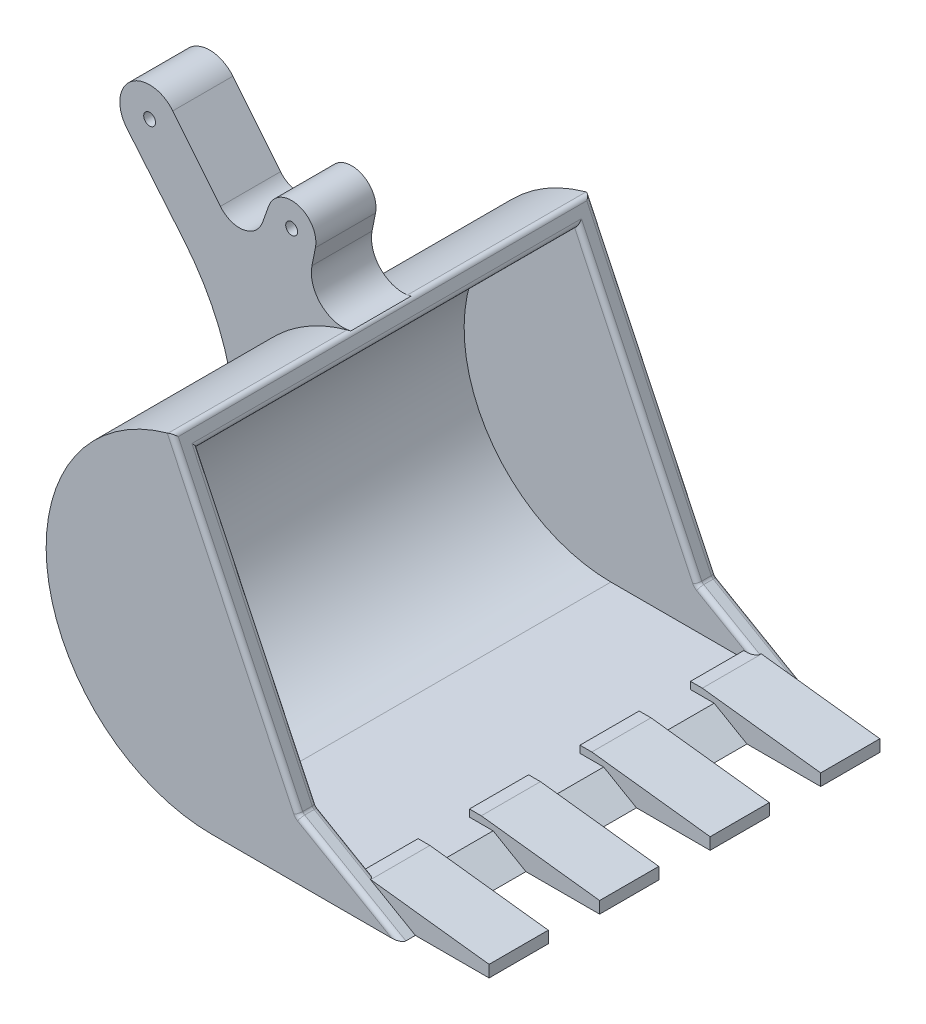
from build123d import *

# Parameters (mm, degrees)
BOSS_EXTRUDE1_DEPTH             = 75
BOSS_EXTRUDE1_DEPTH_BACK        = 101.6
SHELL2_T                        = -8
BOSS_EXTRUDE2_DEPTH             = 12.7
CUT_EXTRUDE1_DEPTH              = 20
CUT_EXTRUDE1_DEPTH_BACK         = 20
SKETCH8_R                       = 2.5
FILLET3_R                       = 2
BOSS_EXTRUDE3_DEPTH             = 3
BOSS_EXTRUDE3_DIRECTION_2_REACH = 518.917
CUT_EXTRUDE4_DEPTH              = 25
LPATTERN2_COUNT                 = 4
LPATTERN2_PITCH                 = 46.7


with BuildPart() as part:
    # Sketch3 → Boss-Extrude1 (new, two sides: drawn at the far end of the back side and taken through both)
    with BuildSketch(Plane.XY.offset(-BOSS_EXTRUDE1_DEPTH_BACK)):
        with BuildLine():
            Line((-323.559783679, 25), (-280.25851349, 0))
            Line((-280.25851349, 0), (-360.25851349, 0))
            ThreePointArc((-360.25851349, 0), (-429.739955011, 61.495337509), (-377.141833761, 137.933449026))
            Line((-377.141833761, 137.933449026), (-323.559783679, 25))
        make_face()
    extrude(amount=BOSS_EXTRUDE1_DEPTH + BOSS_EXTRUDE1_DEPTH_BACK)

    # Shell2
    shell2_openings = [part.faces().sort_by_distance(p)[0] for p in [
        (-350.35080872, 81.466724513, -13.3),
        (-301.909148584, 12.5, -13.3),
    ]]
    offset(amount=SHELL2_T, openings=shell2_openings, kind=Kind.INTERSECTION)

    # Fillet3
    fillet3_edges = [part.edges().sort_by_distance(p)[0] for p in [
        (-301.909148584, 12.5, -101.6),
        (-350.35080872, 81.466724513, -101.6),
        (-301.909148584, 12.5, 75),
        (-350.35080872, 81.466724513, 75),
        (-323.559783679, 25, 71),
        (-373.633981695, 130.540043362, -13.3),
        (-348.596882687, 77.770021681, -93.6),
        (-308.837351815, 16.5, -93.6),
        (-308.837351815, 16.5, 67),
        (-348.596882687, 77.770021681, 67),
        (-377.141833761, 137.933449026, -13.3),
        (-323.559783679, 25, -97.6),
    ]]
    fillet(fillet3_edges, radius=FILLET3_R)

    # Sketch17 → Boss-Extrude3 (add)
    with BuildSketch(Plane(origin=(0, 8, 0), x_dir=(1, 0, 0), z_dir=(0, 1, 0))):
        Polygon((-294.11491995, -44), (-304.11491995, -44), (-304.11491995, -69), (-294.11491995, -69), (-249.11491995, -69), (-249.11491995, -44), align=None)
    boss_extrude3 = extrude(amount=BOSS_EXTRUDE3_DEPTH)

    # Boss-Extrude3 direction 2: up to this face of the body (flat: up to its plane)
    boss_extrude3_direction_2_end = Plane(part.part.faces().sort_by_distance((-320.268020141, 0, -13.3))[0])
    # Sketch17 → Boss-Extrude3 direction 2 (add, up to the picked face)
    with BuildSketch(Plane(origin=(0, 8, 0), x_dir=(1, 0, 0), z_dir=(0, 1, 0)), mode=Mode.PRIVATE) as boss_extrude3_direction_2_sk1:
        Polygon((-294.11491995, -44), (-304.11491995, -44), (-304.11491995, -69), (-294.11491995, -69), (-249.11491995, -69), (-249.11491995, -44), align=None)
    boss_extrude3_direction_2_tool1 = split(extrude(boss_extrude3_direction_2_sk1.sketch, amount=-BOSS_EXTRUDE3_DIRECTION_2_REACH, mode=Mode.PRIVATE), bisect_by=boss_extrude3_direction_2_end, keep=Keep.BOTH, mode=Mode.PRIVATE)
    boss_extrude3_direction_2 = boss_extrude3_direction_2_tool1.solids().sort_by(Axis((-276.61492, 8, 56.5), (0, -1, 0)))[0]
    add(boss_extrude3_direction_2)

    # Sketch18 → Cut-Extrude4 (cut)
    with BuildSketch(Plane.XY.offset(69)):
        Polygon((-299.11491995, 11), (-249.11491995, 11), (-249.11491995, 5), align=None)
    cut_extrude4 = extrude(amount=-CUT_EXTRUDE4_DEPTH, mode=Mode.SUBTRACT)

    # LPattern2: Boss-Extrude3, Boss-Extrude3 direction 2, Cut-Extrude4 ×4
    with Locations(*[(0, 0, -i * LPATTERN2_PITCH) for i in range(1, LPATTERN2_COUNT)]):
        add(boss_extrude3)
        add(boss_extrude3_direction_2)
        add(cut_extrude4, mode=Mode.SUBTRACT)


with BuildPart() as body_2:
    # Sketch5 → Boss-Extrude2 (new, symmetric)
    with BuildSketch(Plane.XY):
        with BuildLine():
            Line((-471.81115259, 164.875216113), (-447.626133428, 135.854875839))
            ThreePointArc((-447.626133428, 135.854875839), (-434.348232425, 114.79784848), (-427.033300971, 91.003041609))
            ThreePointArc((-427.033300971, 91.003041609), (-408.219805521, 120.987395175), (-377.141833761, 137.933449026))
            ThreePointArc((-377.141833761, 137.933449026), (-389.656160093, 141.253981011), (-393.550663238, 153.601739572))
            Line((-393.550663238, 153.601739572), (-392.086361367, 160.922015761))
            ThreePointArc((-392.086361367, 160.922015761), (-399.399303926, 172.814588584), (-411.795560573, 166.392342997))
            Line((-411.795560573, 166.392342997), (-414.446186187, 158.99448236))
            ThreePointArc((-414.446186187, 158.99448236), (-422.460035632, 152.280344724), (-432.239552133, 155.976624494))
            Line((-432.239552133, 155.976624494), (-452.355057749, 180.848615454))
            ThreePointArc((-452.355057749, 180.848615454), (-470.128749354, 182.661759446), (-471.81115259, 164.875216113))
        make_face()
    extrude(amount=BOSS_EXTRUDE2_DEPTH, both=True)

    # Sketch8 → Cut-Extrude1 (cut, two sides: drawn at the far end of the back side and taken through both)
    with BuildSketch(Plane.XY.offset(-CUT_EXTRUDE1_DEPTH_BACK)):
        with Locations((-402.141833761, 162.933449026)):
            Circle(SKETCH8_R)
        with Locations((-462.141833761, 172.933449026)):
            Circle(SKETCH8_R)
    extrude(amount=CUT_EXTRUDE1_DEPTH + CUT_EXTRUDE1_DEPTH_BACK, mode=Mode.SUBTRACT)


with BuildPart() as body_2_1:
    # Body-Move/Copy4: moved
    add(body_2.part.moved(Location((0, 0, -13.3))))


solid = Compound([part.part, body_2_1.part])
